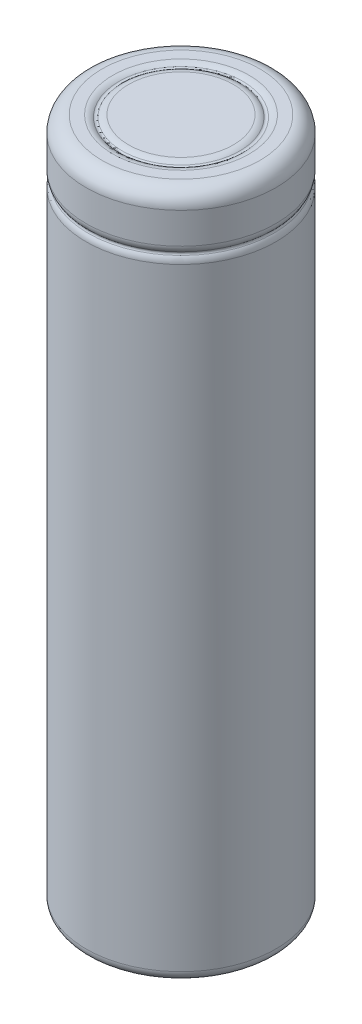
from build123d import *

# Parameters (mm, degrees)
FILLET_1_R = 1
FILLET_2_R = 1.5
FILLET_3_R = 1
FILLET_4_R = 1
FILLET_5_R = 1
FILLET_6_R = 1


with BuildPart() as part:
    # Эскиз1 → Повернуть1 (revolve)
    with BuildSketch(Plane.XY, mode=Mode.PRIVATE) as revolve_1_sk:
        with BuildLine():
            Line((0, 65), (0, 0))
            Line((0, 0), (9, 0))
            Line((9, 0), (9, 59.555686992))
            ThreePointArc((9, 59.555686992), (8.75, 59.805686992), (9, 60.055686992))
            Line((9, 60.055686992), (9, 65))
            Line((9, 65), (5.968291991, 65))
            ThreePointArc((5.968291991, 65), (5.718291991, 64.75), (5.468291991, 65))
            Line((5.468291991, 65), (0, 65))
        make_face()
    revolve(revolve_1_sk.sketch.rotate(Axis((0, 65, 0), (0, -1, 0)), 180), axis=Axis((0, 65, 0), (0, -1, 0)))

    # Скругление1
    fillet_1_edges = [part.edges().sort_by_distance(p)[0] for p in [
        (9, 0, 0),
    ]]
    fillet(fillet_1_edges, radius=FILLET_1_R)

    # Скругление2
    fillet_2_edges = [part.edges().sort_by_distance(p)[0] for p in [
        (9, 65, 0),
    ]]
    fillet(fillet_2_edges, radius=FILLET_2_R)

    # Скругление3
    fillet_3_edges = [part.edges().sort_by_distance(p)[0] for p in [
        (9, 59.555686992, 0),
    ]]
    fillet(fillet_3_edges, radius=FILLET_3_R)

    # Скругление4
    fillet_4_edges = [part.edges().sort_by_distance(p)[0] for p in [
        (9, 60.055686992, 0),
    ]]
    fillet(fillet_4_edges, radius=FILLET_4_R)

    # Скругление5
    fillet_5_edges = [part.edges().sort_by_distance(p)[0] for p in [
        (5.468291991, 65, 0),
    ]]
    fillet(fillet_5_edges, radius=FILLET_5_R)

    # Скругление6
    fillet_6_edges = [part.edges().sort_by_distance(p)[0] for p in [
        (5.968291991, 65, 0),
    ]]
    fillet(fillet_6_edges, radius=FILLET_6_R)


solid = part.part
